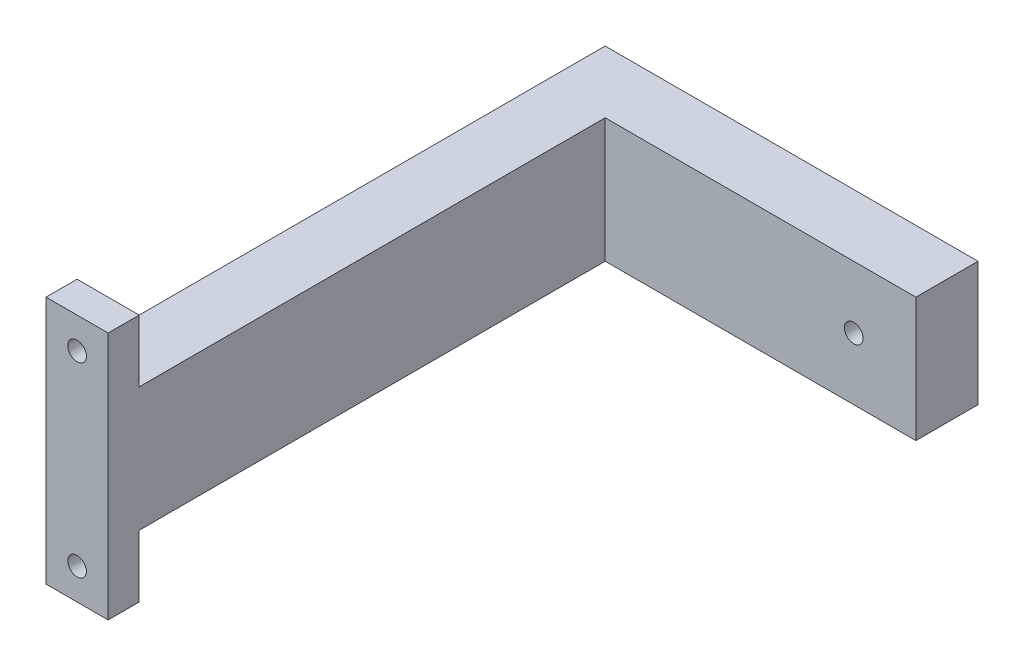
from build123d import *

# Parameters (mm, degrees)
Y_KSEKLIK_EKSTR_ZYON1_DEPTH      = 20
Y_KSEKLIK_EKSTR_ZYON2_DEPTH      = 10
Y_KSEKLIK_EKSTR_ZYON2_DEPTH_BACK = 30
IZIM2_W                          = 10
IZIM2_H                          = 5
IZIM3_R                          = 1.5
KES_EKSTR_ZYON1_DEPTH            = 10
IZIM4_R                          = 1.5
KES_EKSTR_ZYON2_DEPTH            = 10


with BuildPart() as part:
    # Çizim1 → Yükseklik-Ekstrüzyon1 (new body)
    with BuildSketch(Plane(origin=(0, 0, 0), x_dir=(1, 0, 0), z_dir=(0, 1, 0))):
        Polygon((-10, 0), (0, 0), (0, 80), (50, 80), (50, 90), (-10, 90), align=None)
    extrude(amount=Y_KSEKLIK_EKSTR_ZYON1_DEPTH)

    # Çizim2 → Yükseklik-Ekstrüzyon2 (add, two sides: drawn at the far end of the back side and taken through both)
    with BuildSketch(Plane(origin=(0, 20, 0), x_dir=(1, 0, 0), z_dir=(0, 1, 0)).offset(-Y_KSEKLIK_EKSTR_ZYON2_DEPTH_BACK)):
        with Locations((-5, 2.5)):
            Rectangle(IZIM2_W, IZIM2_H)
    extrude(amount=Y_KSEKLIK_EKSTR_ZYON2_DEPTH + Y_KSEKLIK_EKSTR_ZYON2_DEPTH_BACK)

    # Çizim3 → Kes-Ekstrüzyon1 (cut)
    with BuildSketch(Plane(origin=(0, 0, -5), x_dir=(-1, 0, 0), z_dir=(0, 0, -1))):
        with Locations((5, 25)):
            Circle(IZIM3_R)
        with Locations((5, -5)):
            Circle(IZIM3_R)
    extrude(amount=-KES_EKSTR_ZYON1_DEPTH, mode=Mode.SUBTRACT)

    # Çizim4 → Kes-Ekstrüzyon2 (cut)
    with BuildSketch(Plane(origin=(0, 0, -90), x_dir=(-1, 0, 0), z_dir=(0, 0, -1))):
        with Locations((-40, 10)):
            Circle(IZIM4_R)
    extrude(amount=-KES_EKSTR_ZYON2_DEPTH, mode=Mode.SUBTRACT)


solid = part.part
